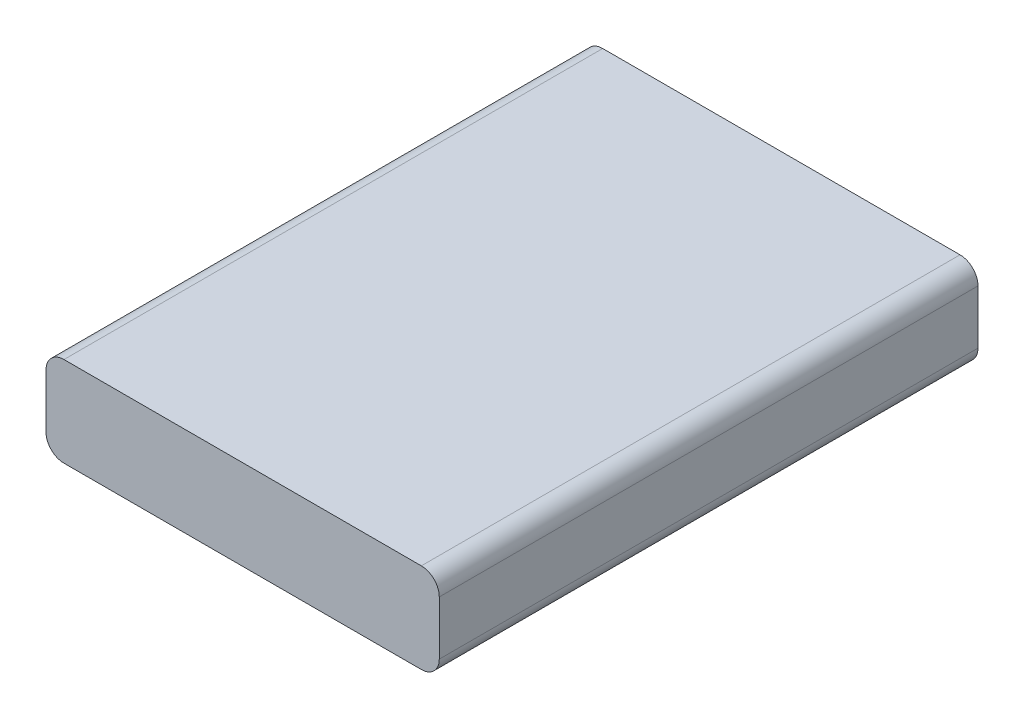
from build123d import *

# Parameters (mm, degrees)
SKETCH_1_W               = 21.9
SKETCH_1_H               = 5
EXTRUDE_1_DEPTH          = 30
FILLET_2_R               = 1
HOLE_WIZARD_M2_5_1_D     = 2.05
HOLE_WIZARD_M2_5_1_DEPTH = 7.25
HOLE_WIZARD_M2_5_1_TIP   = 0.615882135


with BuildPart() as part:
    # 草图1 → 凸台-拉伸1 (new body)
    with BuildSketch(Plane.XY):
        Rectangle(SKETCH_1_W, SKETCH_1_H)
    extrude(amount=EXTRUDE_1_DEPTH)

    # 圆角2
    fillet_2_edges = [part.edges().sort_by_distance(p)[0] for p in [
        (10.95, -2.5, 15),
        (-10.95, -2.5, 15),
        (-10.95, 2.5, 15),
        (10.95, 2.5, 15),
    ]]
    fillet(fillet_2_edges, radius=FILLET_2_R)

    # M2.5 螺纹孔1
    with Locations(Plane(origin=(0, 0, 0), x_dir=(-1, 0, 0), z_dir=(0, 0, -1))):
        with Locations((-5, 0), (5, 0)):
            Hole(HOLE_WIZARD_M2_5_1_D / 2, depth=HOLE_WIZARD_M2_5_1_DEPTH)
            with Locations((0, 0, -(HOLE_WIZARD_M2_5_1_DEPTH + HOLE_WIZARD_M2_5_1_TIP / 2))):  # 118° drill point
                Cone(0, HOLE_WIZARD_M2_5_1_D / 2, HOLE_WIZARD_M2_5_1_TIP, mode=Mode.SUBTRACT)


solid = part.part
